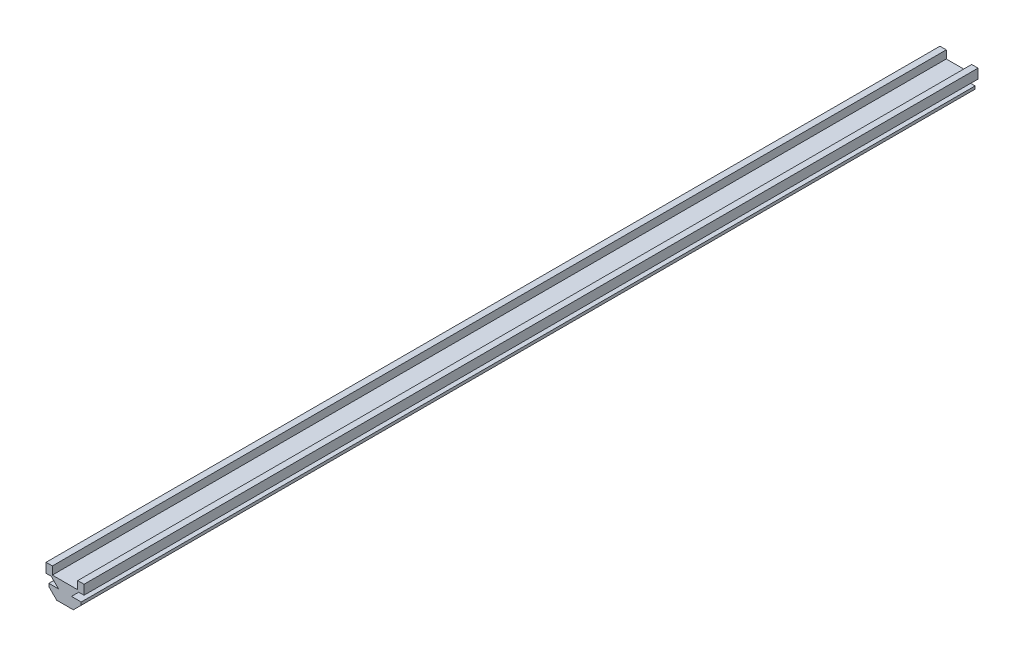
from build123d import *

# Parameters (mm, degrees)
SALIENTE_EXTRUIR1_DEPTH = 282


with BuildPart() as part:
    # Croquis1 → Saliente-Extruir1 (new body)
    with BuildSketch(Plane.XY):
        Polygon((7.372056275, -5.675), (10, -5.675), (10, 0.5), (6, 0.5), (6, 3), (4, 3), (4, 0), (4.4, 0), (4.95, 0), (5.657106781, 0), (7.957106781, -2.3), (4.9, -2.3), (4.9, -3.202943725), align=None)
        Polygon((10, -5.675), (12.627943725, -5.675), (15.1, -3.202943725), (15.1, -2.3), (12.042893219, -2.3), (14.342893219, 0), (16, 0), (16, 3), (14, 3), (14, 0.5), (10, 0.5), align=None)
    extrude(amount=SALIENTE_EXTRUIR1_DEPTH)


solid = part.part
